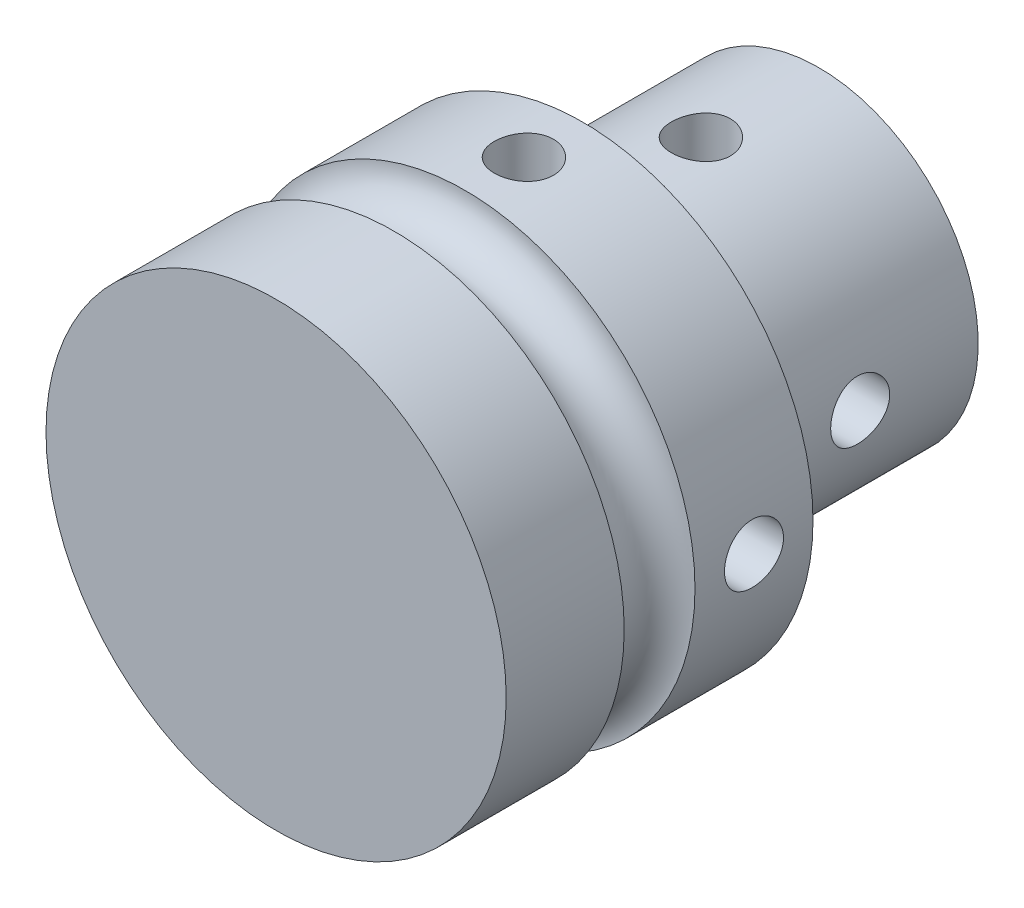
from build123d import *

# Parameters (mm, degrees)
ESBO_O2_R                = 9.75
RESSALTO_EXTRUS_O1_DEPTH = 13
ESBO_O3_R                = 1.5
ESBO_O4_R                = 6.75
RESSALTO_EXTRUS_O2_DEPTH = 10
PADR_OCIRCULAR1_COUNT    = 4
PADR_OCIRCULAR2_COUNT    = 4


with BuildPart() as part:
    # Esboço2 → Ressalto-extrusão1 (new body)
    with BuildSketch(Plane.XY):
        with Locations(Location((0, 0, 0), (0, 0, 180))):
            Circle(ESBO_O2_R)
    extrude(amount=RESSALTO_EXTRUS_O1_DEPTH)

    # Esboço3 → Corte-Revolução1 (revolve, cut)
    with BuildSketch(Plane(origin=(0, 0, 0), x_dir=(1, 0, 0), z_dir=(0, 1, 0)), mode=Mode.PRIVATE) as corte_revolu_o1_sk:
        with Locations((9.75, -6.5)):
            Circle(ESBO_O3_R)
    revolve(corte_revolu_o1_sk.sketch.rotate(Axis((0, 0, 0), (0, 0, 1)), 180), axis=Axis((0, 0, 0), (0, 0, 1)), mode=Mode.SUBTRACT)

    # Esboço4 → Ressalto-extrusão2 (add)
    with BuildSketch(Plane(origin=(0, 0, 0), x_dir=(-1, 0, 0), z_dir=(0, 0, -1))):
        Circle(ESBO_O4_R)
    extrude(amount=RESSALTO_EXTRUS_O2_DEPTH)

    # Esboço15 → Broca de rosquear para tarraxa de M36 (revolve, cut)
    with BuildSketch(Plane(origin=(0, 9.75, 2.5), x_dir=(0, 0, 1), z_dir=(1, 0, 0))):
        Polygon((0, 0), (0, 8.751075774), (1.25, 8), (1.25, 0), align=None)
    broca_de_rosquear_para_tarraxa_de_m36 = revolve(axis=Axis((0, 16.1, 2.5), (0, -1, 0)), mode=Mode.SUBTRACT)

    # PadrãoCircular1: Broca de rosquear para tarraxa de M36 ×4 about axis
    padr_ocircular1_axis = Axis((0, 0, 0), (0, 0, 1))
    for i in range(1, PADR_OCIRCULAR1_COUNT):
        add(broca_de_rosquear_para_tarraxa_de_m36.rotate(padr_ocircular1_axis, i * 360 / PADR_OCIRCULAR1_COUNT), mode=Mode.SUBTRACT)

    # Esboço19 → Broca de rosquear para tarraxa de M310 (revolve, cut)
    with BuildSketch(Plane(origin=(0, 6.75, -5), x_dir=(0, 0, 1), z_dir=(1, 0, 0))):
        Polygon((0, 0), (0, 5.751075774), (1.25, 5), (1.25, 0), align=None)
    broca_de_rosquear_para_tarraxa_de_m310 = revolve(axis=Axis((0, 13.1, -5), (0, -1, 0)), mode=Mode.SUBTRACT)

    # PadrãoCircular2: Broca de rosquear para tarraxa de M310 ×4 about axis
    padr_ocircular2_axis = Axis((0, 0, 0), (0, 0, 1))
    for i in range(1, PADR_OCIRCULAR2_COUNT):
        add(broca_de_rosquear_para_tarraxa_de_m310.rotate(padr_ocircular2_axis, i * 360 / PADR_OCIRCULAR2_COUNT), mode=Mode.SUBTRACT)


solid = part.part
